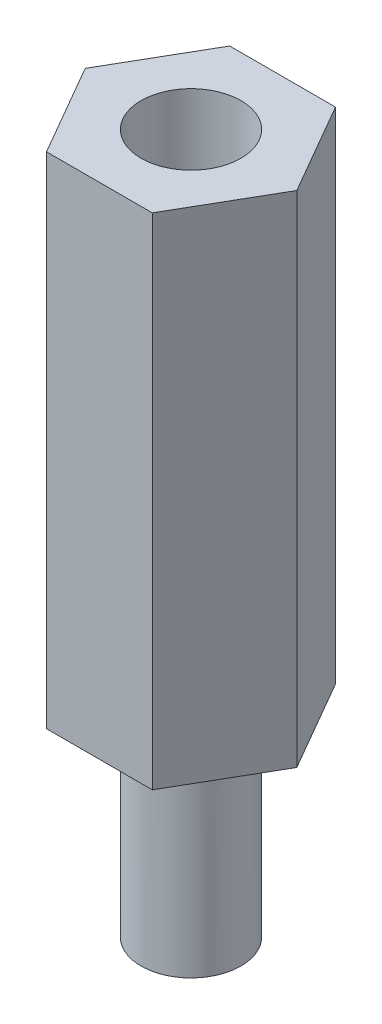
from build123d import *

# Parameters (mm, degrees)
ESQUISSE1_R             = 1.5
BOSS_EXTRU_1_DEPTH      = 15
BOSS_EXTRU_2_DEPTH      = 6
BOSS_EXTRU_2_DEPTH_BACK = 1
ESQUISSE2_R             = 1.5


with BuildPart() as part:
    # Esquisse1 → Boss.-Extru.1 (new body)
    with BuildSketch(Plane(origin=(0, 0, 0), x_dir=(1, 0, 0), z_dir=(0, 1, 0))):
        Polygon((1.58771324, 2.75), (-1.58771324, 2.75), (-3.175426481, 0), (-1.58771324, -2.75), (1.58771324, -2.75), (3.175426481, 0), align=None)
        with Locations(Location((0, 0, 0), (0, 0, 270))):
            Circle(ESQUISSE1_R, mode=Mode.SUBTRACT)
    extrude(amount=BOSS_EXTRU_1_DEPTH)

    # Esquisse2 → Boss.-Extru.2 (add, two sides: drawn at the far end of the back side and taken through both)
    with BuildSketch(Plane.XZ.offset(-BOSS_EXTRU_2_DEPTH_BACK)):
        with Locations(Location((0, 0, 0), (0, 0, 270))):
            Circle(ESQUISSE2_R)
    extrude(amount=BOSS_EXTRU_2_DEPTH + BOSS_EXTRU_2_DEPTH_BACK)


solid = part.part
